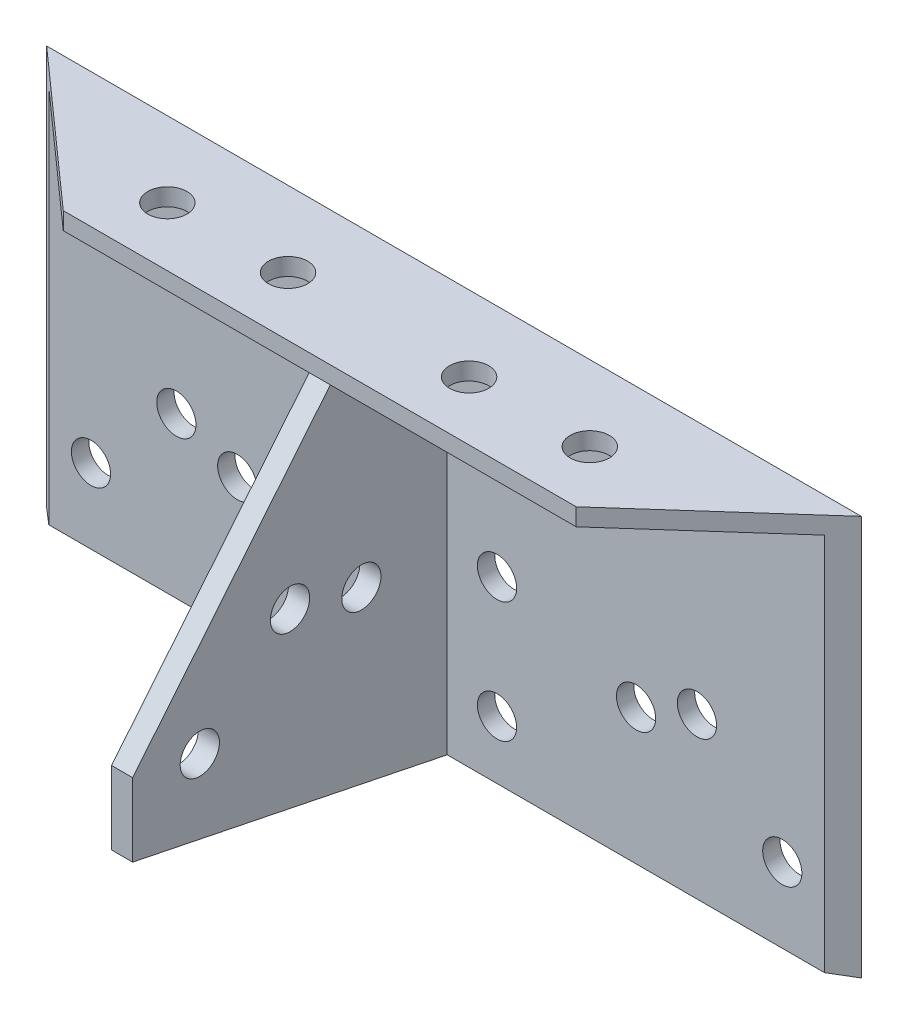
from build123d import *

# Parameters (mm, degrees)
SKETCH_1_W          = 540
SKETCH_1_H          = 265
SKETCH_1_R          = 13
EXTRUDE_553_DEPTH   = 11.5
SKETCH_2_W          = 540
SKETCH_2_H          = 11.5
EXTRUDE_1_DEPTH     = 77.5
CUT_EXTRUDE_1_DEPTH = 609.067430471
SKETCH_4_R          = 13
CUT_EXTRUDE_2_DEPTH = 609.067430471
SKETCH_5_W          = 14
SKETCH_5_H          = 253.5
EXTRUDE_2_DEPTH     = 208.5
SKETCH_6_R          = 13
CUT_EXTRUDE_3_DEPTH = 442.988687638
CUT_EXTRUDE_4_DEPTH = 442.988687638


with BuildPart() as part:
    # 草图1 → Extrude 553 (new body)
    with BuildSketch(Plane.XY):
        with Locations((270, 132.5)):
            Rectangle(SKETCH_1_W, SKETCH_1_H)
        with Locations((97.46594539, 108.46594539)):
            Circle(SKETCH_1_R, mode=Mode.SUBTRACT)
        with Locations((40.897402896, 51.897402896)):
            Circle(SKETCH_1_R, mode=Mode.SUBTRACT)
        with Locations(Location((499.102597104, 51.897402896, 0), (0, 0, 180))):
            Circle(SKETCH_1_R, mode=Mode.SUBTRACT)
        with Locations(Location((402.170987639, 92.261534081, 0), (0, 0, 180))):
            Circle(SKETCH_1_R, mode=Mode.SUBTRACT)
        with Locations((230, 121)):
            Circle(SKETCH_1_R, mode=Mode.SUBTRACT)
        with Locations((230, 41)):
            Circle(SKETCH_1_R, mode=Mode.SUBTRACT)
        with Locations(Location((310, 41, 0), (0, 0, 180))):
            Circle(SKETCH_1_R, mode=Mode.SUBTRACT)
        with Locations(Location((310, 121, 0), (0, 0, 180))):
            Circle(SKETCH_1_R, mode=Mode.SUBTRACT)
        with Locations((137.829012361, 92.261534081)):
            Circle(SKETCH_1_R, mode=Mode.SUBTRACT)
        with Locations(Location((442.53405461, 108.46594539, 0), (0, 0, 180))):
            Circle(SKETCH_1_R, mode=Mode.SUBTRACT)
    extrude(amount=EXTRUDE_553_DEPTH)

    # 草图2 → 凸台-拉伸1 (add)
    with BuildSketch(Plane.XY.offset(11.5)):
        with Locations((270, 259.25)):
            Rectangle(SKETCH_2_W, SKETCH_2_H)
    extrude(amount=EXTRUDE_1_DEPTH)

    # 草图3 → 切除-拉伸1 (cut, through all)
    with BuildSketch(Plane(origin=(0, 265, 0), x_dir=(-1, 0, 0), z_dir=(0, 1, 0))):
        Polygon((0, 0), (-100, 89), (0, 89), align=None)
        Polygon((-540, 0), (-440, 89), (-540, 89), align=None)
    extrude(amount=-CUT_EXTRUDE_1_DEPTH, mode=Mode.SUBTRACT)

    # 草图4 → 切除-拉伸2 (cut, through all)
    with BuildSketch(Plane(origin=(0, 265, 0), x_dir=(-1, 0, 0), z_dir=(0, 1, 0))):
        with Locations(Location((-210, 50, 0), (0, 0, 90))):
            Circle(SKETCH_4_R)
        with Locations(Location((-130, 50, 0), (0, 0, 90))):
            Circle(SKETCH_4_R)
        with Locations(Location((-410, 50, 0), (0, 0, 90))):
            Circle(SKETCH_4_R)
        with Locations(Location((-330, 50, 0), (0, 0, 90))):
            Circle(SKETCH_4_R)
    extrude(amount=-CUT_EXTRUDE_2_DEPTH, mode=Mode.SUBTRACT)

    # 草图5 → 凸台-拉伸2 (add)
    with BuildSketch(Plane.XY.offset(11.5)):
        with Locations((270, 126.75)):
            Rectangle(SKETCH_5_W, SKETCH_5_H)
    extrude(amount=EXTRUDE_2_DEPTH)

    # 草图6 → 切除-拉伸3 (cut, through all)
    with BuildSketch(Plane(origin=(277, 0, 0), x_dir=(0, 0, -1), z_dir=(1, 0, 0))):
        with Locations((-115.693003517, 138.161774652)):
            Circle(SKETCH_6_R)
        with Locations((-175.485749012, 85.012667545)):
            Circle(SKETCH_6_R)
        with Locations((-68.400421337, 126.93798921)):
            Circle(SKETCH_6_R)
        Polygon((-89, 253.5), (-220, 93.5), (-220, 253.5), align=None)
        Polygon((-220, 45), (0, 0), (-220, 0), align=None)
    extrude(amount=-CUT_EXTRUDE_3_DEPTH, mode=Mode.SUBTRACT)

    # 草图7 → 切除-拉伸4 (cut, through all)
    with BuildSketch(Plane.ZY.offset(-277)):
        Polygon((0, 0), (11.5, 2.352272727), (11.5, 0), align=None)
    extrude(amount=-CUT_EXTRUDE_4_DEPTH, mode=Mode.SUBTRACT)


solid = part.part
